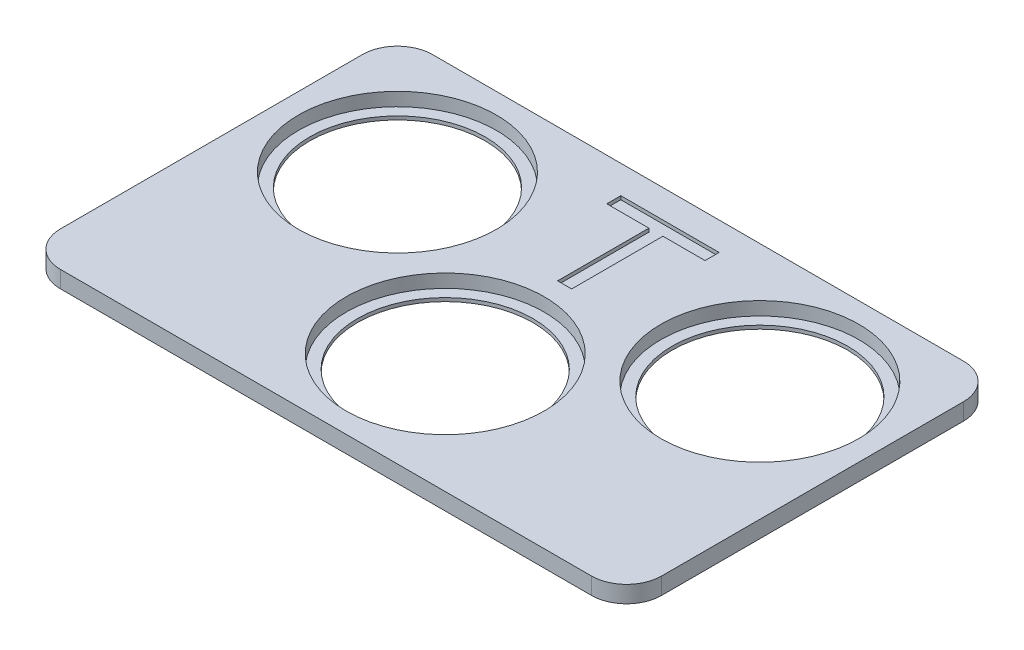
from build123d import *

# Parameters (mm, degrees)
SKETCH1_W               = 85.6
SKETCH1_H               = 52.98
BOSS_EXTRUDE1_DEPTH     = 2.4
SKETCH2_R               = 14.1
CUT_EXTRUDE1_DEPTH      = 1.9
SKETCH3_R               = 12.5
CUT_EXTRUDE2_DEPTH      = 1.75
FILLET1_R               = 5
CUT_EXTRUDE3_DEPTH      = 51.39166697
CUT_EXTRUDE3_DEPTH_BACK = 0.5


with BuildPart() as part:
    # Sketch1 → Boss-Extrude1 (new body)
    with BuildSketch(Plane(origin=(0, 0, 0), x_dir=(1, 0, 0), z_dir=(0, 1, 0))):
        Rectangle(SKETCH1_W, SKETCH1_H)
    extrude(amount=BOSS_EXTRUDE1_DEPTH)

    # Sketch2 → Cut-Extrude1 (cut)
    with BuildSketch(Plane(origin=(0, 2.4, 0), x_dir=(1, 0, 0), z_dir=(0, 1, 0))):
        with Locations(Location((-25.8, 9.49, 0), (0, 0, 270))):
            Circle(SKETCH2_R)
        with Locations(Location((0, -9.51, 0), (0, 0, 270))):
            Circle(SKETCH2_R)
        with Locations(Location((25.8, 9.49, 0), (0, 0, 270))):
            Circle(SKETCH2_R)
    extrude(amount=-CUT_EXTRUDE1_DEPTH, mode=Mode.SUBTRACT)

    # Sketch3 → Cut-Extrude2 (cut)
    with BuildSketch(Plane(origin=(0, 0.5, 0), x_dir=(1, 0, 0), z_dir=(0, 1, 0))):
        with Locations(Location((-25.8, 9.49, 0), (0, 0, 270))):
            Circle(SKETCH3_R)
        with Locations(Location((0, -9.51, 0), (0, 0, 270))):
            Circle(SKETCH3_R)
        with Locations(Location((25.8, 9.49, 0), (0, 0, 270))):
            Circle(SKETCH3_R)
    extrude(amount=-CUT_EXTRUDE2_DEPTH, mode=Mode.SUBTRACT)

    # Fillet1
    fillet1_edges = [part.edges().sort_by_distance(p)[0] for p in [
        (42.8, 1.2, 26.49),
        (-42.8, 1.2, 26.49),
        (-42.8, 1.2, -26.49),
        (42.8, 1.2, -26.49),
    ]]
    fillet(fillet1_edges, radius=FILLET1_R)

    # Sketch4 → Cut-Extrude3 (cut, two sides: drawn at the far end of the back side and taken through both)
    with BuildSketch(Plane(origin=(0, 2.4, 0), x_dir=(1, 0, 0), z_dir=(0, 1, 0)).offset(-CUT_EXTRUDE3_DEPTH_BACK)):
        Polygon((-7, 20.49), (-1, 20.49), (-1, 7.49), (1, 7.49), (1, 20.49), (7, 20.49), (7, 22.49), (-7, 22.49), align=None)
    extrude(amount=CUT_EXTRUDE3_DEPTH + CUT_EXTRUDE3_DEPTH_BACK, mode=Mode.SUBTRACT)


solid = part.part
